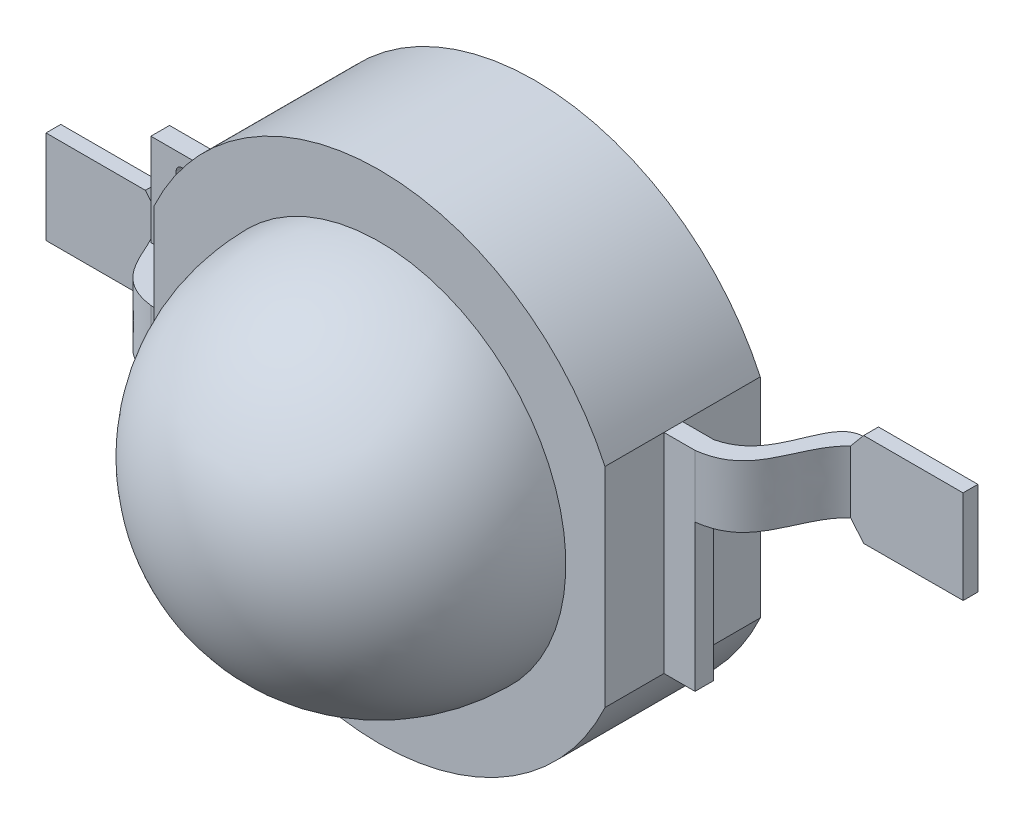
from build123d import *

# Parameters (mm, degrees)
REVOLVE1_ANGLE      = 180
SKETCH3_R           = 3
BOSS_EXTRUDE1_DEPTH = 2.5
BOSS_EXTRUDE2_DEPTH = 0.3
BOSS_EXTRUDE3_DEPTH = 1
BOSS_EXTRUDE4_DEPTH = 0.238292
SKETCH8_W           = 0.5
SKETCH8_H           = 3.36041664
BOSS_EXTRUDE5_DEPTH = 0.3
BOSS_EXTRUDE6_DEPTH = 1
BOSS_EXTRUDE7_DEPTH = 0.238292


with BuildPart() as part:
    # Sketch2 → Revolve1 (revolve)
    with BuildSketch(Plane.XY):
        with BuildLine():
            Line((0, 3), (0, -3))
            ThreePointArc((0, -3), (-3, 0), (0, 3))
        make_face()
    revolve(axis=Axis((0, 3, 0), (0, 1, 0)), revolution_arc=REVOLVE1_ANGLE)


with BuildPart() as body_2:
    # Sketch3 → Boss-Extrude1 (new body)
    # profile 1 of 3: a face of its own
    with BuildSketch(Plane(origin=(0, 0, 0), x_dir=(-1, 0, 0), z_dir=(0, 0, -1))):
        with BuildLine():
            Line((1.68020832, 3.63), (-1.68020832, 3.63))
            ThreePointArc((-1.68020832, 3.63), (-2.828427125, 2.828427125), (-3.63, 1.68020832))
            Line((-3.63, 1.68020832), (-3.63, -1.68020832))
            ThreePointArc((-3.63, -1.68020832), (-2.828427125, -2.828427125), (-1.68020832, -3.63))
            Line((-1.68020832, -3.63), (1.68020832, -3.63))
            ThreePointArc((1.68020832, -3.63), (2.828427125, -2.828427125), (3.63, -1.68020832))
            Line((3.63, -1.68020832), (3.63, 1.68020832))
            ThreePointArc((3.63, 1.68020832), (2.828427125, 2.828427125), (1.68020832, 3.63))
        make_face()
        Circle(SKETCH3_R, mode=Mode.SUBTRACT)
    # profile 2 of 3: a face of its own
    with BuildSketch(Plane(origin=(0, 0, 0), x_dir=(-1, 0, 0), z_dir=(0, 0, -1))):
        with BuildLine():
            ThreePointArc((1.68020832, 3.63), (0, 4), (-1.68020832, 3.63))
            Line((-1.68020832, 3.63), (1.68020832, 3.63))
        make_face()
    # profile 3 of 3: a face of its own
    with BuildSketch(Plane(origin=(0, 0, 0), x_dir=(-1, 0, 0), z_dir=(0, 0, -1))):
        with BuildLine():
            Line((1.68020832, -3.63), (-1.68020832, -3.63))
            ThreePointArc((-1.68020832, -3.63), (0, -4), (1.68020832, -3.63))
        make_face()
    extrude(amount=BOSS_EXTRUDE1_DEPTH)

    # Sketch4 → Boss-Extrude2 (add)
    with BuildSketch(Plane.XY.offset(-1.25)):
        Polygon((-3.63, -1.68020832), (-3.63, 1.68020832), (-4.63, 1.68020832), (-4.63, 0.197046936), (-4.53, 0.197046936), (-4.53, -0.68020832), (-4.63, -0.68020832), (-4.63, -1.68020832), align=None)
        with BuildLine():
            ThreePointArc((-4.222869936, 1.398358142), (-4.13, 1.491228079), (-4.037130064, 1.398358142))
            Line((-4.037130064, 1.398358142), (-4.037130064, 0.39726547))
            ThreePointArc((-4.037130064, 0.39726547), (-4.13, 0.304395534), (-4.222869936, 0.39726547))
            Line((-4.222869936, 0.39726547), (-4.222869936, 1.398358142))
        make_face(mode=Mode.SUBTRACT)
    extrude(amount=BOSS_EXTRUDE2_DEPTH)

    # Sketch5 → Boss-Extrude3 (add)
    with BuildSketch(Plane.XZ.offset(1.68020832)):
        with BuildLine():
            add(Edge.make_bspline(
                [(-4.63, -0.95), (-5.463341402, -1.05483435), (-5.371978935, -1.839519927), (-5.820491324, -2.261707818)],
                knots=[0, 0, 0, 0, 1, 1, 1, 1], degree=3))
            Line((-5.820491324, -2.261707818), (-5.820491324, -2.5))
            add(Edge.make_bspline(
                [(-4.63, -1.25), (-5.442861914, -1.43504305), (-5.234464185, -2.519833805), (-5.820491324, -2.5)],
                knots=[0, 0, 0, 0, 0.623821485, 0.623821485, 0.623821485, 0.623821485], degree=3))
            Line((-4.63, -1.25), (-4.63, -0.95))
        make_face()
    extrude(amount=-BOSS_EXTRUDE3_DEPTH)

    # Sketch6 → Boss-Extrude4 (add)
    with BuildSketch(Plane(origin=(0, 0, -2.5), x_dir=(-1, 0, 0), z_dir=(0, 0, -1))):
        Polygon((5.820491324, -0.68020832), (6.030266232, -0.43020832), (7.630266232, -0.43020832), (7.630266232, -1.93020832), (6.030266232, -1.93020832), (5.820491324, -1.68020832), align=None)
    extrude(amount=-BOSS_EXTRUDE4_DEPTH)

    # Sketch8 → Boss-Extrude5 (add)
    with BuildSketch(Plane.XY.offset(-1.25)):
        with Locations((3.88, 0)):
            Rectangle(SKETCH8_W, SKETCH8_H)
    extrude(amount=BOSS_EXTRUDE5_DEPTH)

    # Sketch9 → Boss-Extrude6 (add)
    with BuildSketch(Plane(origin=(0, 1.68020832, 0), x_dir=(1, 0, 0), z_dir=(0, 1, 0))):
        with BuildLine():
            add(Edge.make_bspline(
                [(5.320491324, 2.261707818), (4.871978935, 1.839519927), (4.963341402, 1.05483435), (4.13, 0.95)],
                knots=[0, 0, 0, 0, 1, 1, 1, 1], degree=3))
            Line((4.13, 0.95), (4.13, 1.25))
            add(Edge.make_bspline(
                [(4.13, 1.25), (4.942861914, 1.43504305), (4.734464185, 2.519833805), (5.320491324, 2.5)],
                knots=[0, 0, 0, 0, 0.623821485, 0.623821485, 0.623821485, 0.623821485], degree=3))
            Line((5.320491324, 2.5), (5.320491324, 2.261707818))
        make_face()
    extrude(amount=-BOSS_EXTRUDE6_DEPTH)


with BuildPart() as body_3:
    # Sketch10 → Boss-Extrude7 (new body)
    with BuildSketch(Plane(origin=(0, 0, -2.5), x_dir=(-1, 0, 0), z_dir=(0, 0, -1))):
        Polygon((-5.320491324, 1.68020832), (-5.532611235, 1.933002987), (-7.132611235, 1.933002987), (-7.134924542, 0.433006554), (-5.534932153, 0.4280715), (-5.322033529, 0.680210699), align=None)
    extrude(amount=-BOSS_EXTRUDE7_DEPTH)


solid = Compound([part.part, body_2.part, body_3.part])
